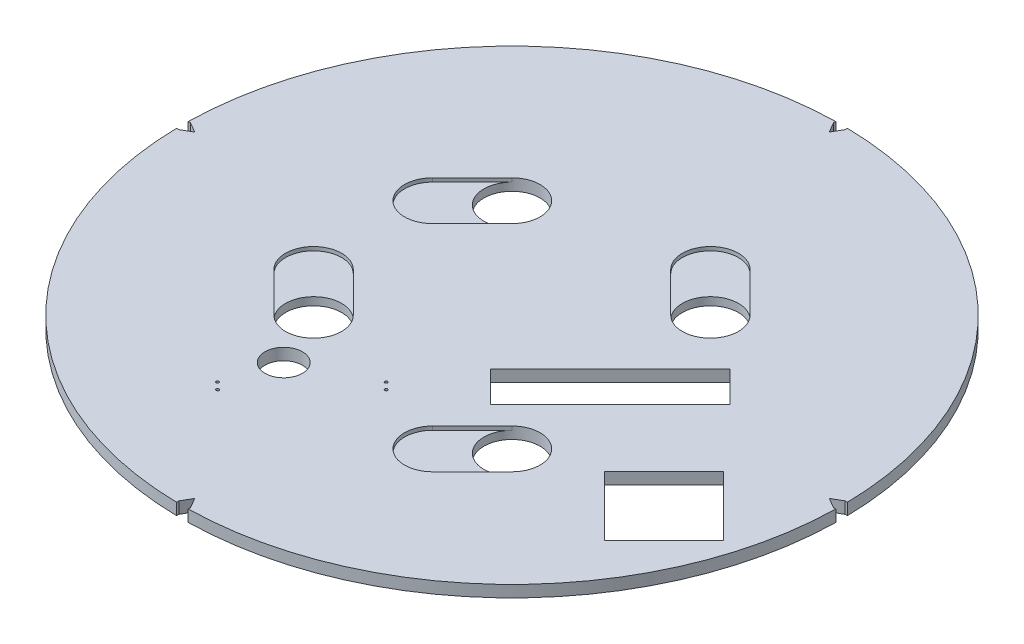
from build123d import *
from build123d.topology import SkipClean

# Parameters (mm, degrees)
SKETCH_1_R               = 705
EXTRUDE_1_DEPTH          = 25
CUT_EXTRUDE_1_REACH      = 999.334
PATTERN_CIRCULAR_1_COUNT = 4
CUT_EXTRUDE_2_REACH      = 999.177
SKETCH_8_R               = 60
CUT_EXTRUDE_3_DEPTH      = 998.177266087
CUT_EXTRUDE_7_DEPTH      = 998.177266087
CUT_EXTRUDE_8_DEPTH      = 998.177266087
SKETCH_18_R              = 40
CUT_EXTRUDE_13_DEPTH     = 998.177266087
SKETCH_19_R              = 3
CUT_EXTRUDE_14_DEPTH     = 100
CUT_EXTRUDE_15_DEPTH     = 8


with BuildPart() as part:
    # 草图1 → 凸台-拉伸1 (new body)
    with BuildSketch(Plane(origin=(0, 0, 0), x_dir=(1, 0, 0), z_dir=(0, 1, 0))):
        with Locations(Location((0, 0, 0), (0, 0, 270))):
            Circle(SKETCH_1_R)
    extrude(amount=EXTRUDE_1_DEPTH)

    # 草图2 → 切除-拉伸1 (cut, up to next)
    with BuildSketch(Plane(origin=(0, 25, 0), x_dir=(1, 0, 0), z_dir=(0, 1, 0)), mode=Mode.PRIVATE) as cut_extrude_1_sk1:
        with BuildLine():
            Line((-12.5, -699.994189271), (-12.5, -704.889175687))
            ThreePointArc((-12.5, -704.889175687), (0, -705), (12.5, -704.889175687))
            Line((12.5, -704.889175687), (12.5, -699.994189271))
            Line((12.5, -699.994189271), (0, -678.343554177))
            Line((0, -678.343554177), (-12.5, -699.994189271))
        make_face()
    cut_extrude_1_tool1 = extrude(cut_extrude_1_sk1.sketch, amount=-CUT_EXTRUDE_1_REACH, mode=Mode.PRIVATE) & part.part
    cut_extrude_1 = cut_extrude_1_tool1.solids().sort_by_distance((0, 25, 695.82939))[0]
    add(cut_extrude_1, mode=Mode.SUBTRACT)

    # 阵列(圆周)1: 切除-拉伸1 ×4 about axis
    pattern_circular_1_axis = Axis((0, 0, 0), (0, 1, 0))
    for i in range(1, PATTERN_CIRCULAR_1_COUNT):
        add(cut_extrude_1.rotate(pattern_circular_1_axis, i * 360 / PATTERN_CIRCULAR_1_COUNT), mode=Mode.SUBTRACT)

    # 草图8 → 切除-拉伸2 (cut, up to next)
    with BuildSketch(Plane(origin=(0, 25, 0), x_dir=(1, 0, 0), z_dir=(0, 1, 0)), mode=Mode.PRIVATE) as cut_extrude_2_sk1:
        with Locations(Location((247.487373415, -247.487373415, 0), (0, 0, 270))):
            Circle(SKETCH_8_R)
    cut_extrude_2_tool1 = extrude(cut_extrude_2_sk1.sketch, amount=-CUT_EXTRUDE_2_REACH, mode=Mode.PRIVATE) & part.part
    # 草图8 → 切除-拉伸2 (cut, up to next)
    with BuildSketch(Plane(origin=(0, 25, 0), x_dir=(1, 0, 0), z_dir=(0, 1, 0)), mode=Mode.PRIVATE) as cut_extrude_2_sk2:
        with Locations(Location((-212.132034356, -212.132034356, 0), (0, 0, 270))):
            Circle(SKETCH_8_R)
    cut_extrude_2_tool2 = extrude(cut_extrude_2_sk2.sketch, amount=-CUT_EXTRUDE_2_REACH, mode=Mode.PRIVATE) & part.part
    # 草图8 → 切除-拉伸2 (cut, up to next)
    with BuildSketch(Plane(origin=(0, 25, 0), x_dir=(1, 0, 0), z_dir=(0, 1, 0)), mode=Mode.PRIVATE) as cut_extrude_2_sk3:
        with Locations(Location((-212.132034356, 212.132034356, 0), (0, 0, 270))):
            Circle(SKETCH_8_R)
    cut_extrude_2_tool3 = extrude(cut_extrude_2_sk3.sketch, amount=-CUT_EXTRUDE_2_REACH, mode=Mode.PRIVATE) & part.part
    # 草图8 → 切除-拉伸2 (cut, up to next)
    with BuildSketch(Plane(origin=(0, 25, 0), x_dir=(1, 0, 0), z_dir=(0, 1, 0)), mode=Mode.PRIVATE) as cut_extrude_2_sk4:
        with Locations(Location((212.132034356, 212.132034356, 0), (0, 0, 270))):
            Circle(SKETCH_8_R)
    cut_extrude_2_tool4 = extrude(cut_extrude_2_sk4.sketch, amount=-CUT_EXTRUDE_2_REACH, mode=Mode.PRIVATE) & part.part
    add(cut_extrude_2_tool1.solids().sort_by_distance((247.487373, 25, 247.487373))[0], mode=Mode.SUBTRACT)
    add(cut_extrude_2_tool2.solids().sort_by_distance((-212.132034, 25, 212.132034))[0], mode=Mode.SUBTRACT)
    add(cut_extrude_2_tool3.solids().sort_by_distance((-212.132034, 25, -212.132034))[0], mode=Mode.SUBTRACT)
    add(cut_extrude_2_tool4.solids().sort_by_distance((212.132034, 25, -212.132034))[0], mode=Mode.SUBTRACT)

    # 草图9 → 切除-拉伸3 (cut, through all)
    with BuildSketch(Plane(origin=(0, 25, 0), x_dir=(1, 0, 0), z_dir=(0, 1, 0))):
        Polygon((388.545974556, -190.514916099), (515.825974556, -63.236474876), (643.105974556, -190.514916099), (515.825974556, -317.793357321), align=None)
    extrude(amount=-CUT_EXTRUDE_3_DEPTH, mode=Mode.SUBTRACT)

    # 草图13 → 切除-拉伸7 (cut, through all)
    with BuildSketch(Plane.XZ):
        Polygon((165.039343844, 165.039343844), (398.093317994, -68.014630305), (332.597815836, -133.510132463), (99.543841687, 99.543841687), align=None)
    extrude(amount=-CUT_EXTRUDE_7_DEPTH, mode=Mode.SUBTRACT)

    # 草图14 → 切除-拉伸8 (cut, through all)
    with BuildSketch(Plane.XZ):
        Polygon((165.039343844, 165.039343844), (99.543841687, 99.543841687), (76.501917102, 122.585766271), (141.99741926, 188.081268429), align=None)
    extrude(amount=-CUT_EXTRUDE_8_DEPTH, mode=Mode.SUBTRACT)

    # 草图18 → 切除-拉伸13 (cut, through all)
    with BuildSketch(Plane(origin=(0, 25, 0), x_dir=(1, 0, 0), z_dir=(0, 1, 0))):
        with Locations(Location((-156.54417142, -331.667653242, 0), (0, 0, 270))):
            Circle(SKETCH_18_R)
    extrude(amount=-CUT_EXTRUDE_13_DEPTH, mode=Mode.SUBTRACT)

    # 草图19 → 切除-拉伸14 (cut)
    with BuildSketch(Plane.XZ):
        with Locations(Location((-10.777149233, 258.231573261, 0), (0, 0, 270))):
            Circle(SKETCH_19_R)
        with Locations(Location((-191.089378436, 438.543802464, 0), (0, 0, 270))):
            Circle(SKETCH_19_R)
        with Locations(Location((3.36498639, 272.373708885, 0), (0, 0, 90))):
            Circle(SKETCH_19_R)
        with Locations(Location((-176.947242812, 452.685938088, 0), (0, 0, 90))):
            Circle(SKETCH_19_R)
    extrude(amount=-CUT_EXTRUDE_14_DEPTH, mode=Mode.SUBTRACT)

    # 草图20 → 切除-拉伸15 (cut)
    with SkipClean():  # the faces are left unmerged after this step: merging them gives an invalid solid
        with BuildSketch(Plane(origin=(0, 25, 0), x_dir=(1, 0, 0), z_dir=(0, 1, 0))):
            with BuildLine():
                Line((169.705627485, 169.705627485), (84.852813742, 254.558441227))
                ThreePointArc((84.852813742, 254.558441227), (84.852813742, 339.41125497), (169.705627485, 339.41125497))
                Line((169.705627485, 339.41125497), (254.558441227, 254.558441227))
                ThreePointArc((254.558441227, 254.558441227), (254.558441227, 169.705627485), (169.705627485, 169.705627485))
            make_face()
            with BuildLine():
                Line((-169.705627485, -169.705627485), (-254.558441227, -84.852813742))
                ThreePointArc((-254.558441227, -84.852813742), (-339.41125497, -84.852813742), (-339.41125497, -169.705627485))
                Line((-339.41125497, -169.705627485), (-254.558441227, -254.558441227))
                ThreePointArc((-254.558441227, -254.558441227), (-169.705627485, -254.558441227), (-169.705627485, -169.705627485))
            make_face()
            with BuildLine():
                Line((-169.705627485, 169.705627485), (-254.558441227, 84.852813742))
                ThreePointArc((-254.558441227, 84.852813742), (-339.41125497, 84.852813742), (-339.41125497, 169.705627485))
                Line((-339.41125497, 169.705627485), (-254.558441227, 254.558441227))
                ThreePointArc((-254.558441227, 254.558441227), (-169.705627485, 254.558441227), (-169.705627485, 169.705627485))
            make_face()
            with BuildLine():
                Line((289.913780286, -289.913780286), (205.060966544, -374.766594029))
                ThreePointArc((205.060966544, -374.766594029), (120.208152802, -374.766594029), (120.208152802, -289.913780286))
                Line((120.208152802, -289.913780286), (205.060966544, -205.060966544))
                ThreePointArc((205.060966544, -205.060966544), (289.913780286, -205.060966544), (289.913780286, -289.913780286))
            make_face()
        extrude(amount=-CUT_EXTRUDE_15_DEPTH, mode=Mode.SUBTRACT)


solid = part.part
